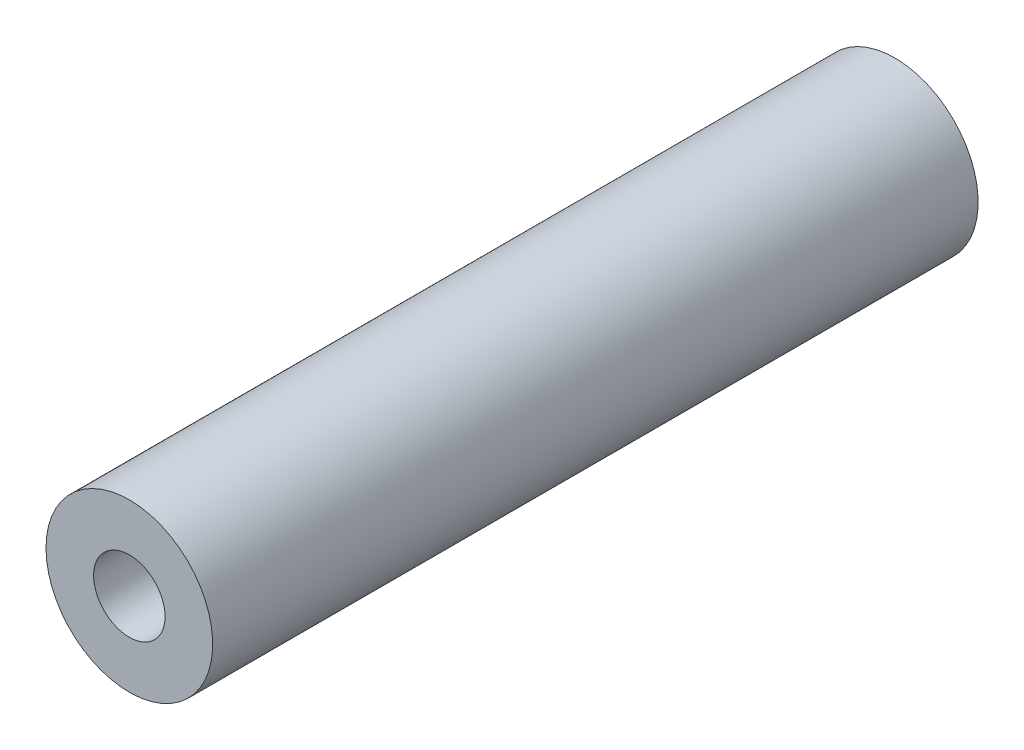
from build123d import *

# Parameters (mm, degrees)
ESBO_O1_R                = 4.9
RESSALTO_EXTRUS_O1_DEPTH = 45
PADR_OCIRCULAR1_COUNT    = 3


with BuildPart() as part:
    # Esboço1 → Ressalto-extrusão1 (new body)
    with BuildSketch(Plane.XY):
        with Locations(Location((0, 0, 0), (0, 0, 180))):
            Circle(ESBO_O1_R)
    extrude(amount=RESSALTO_EXTRUS_O1_DEPTH)

    # Esboço2 → Furo roscado de M51 (revolve, cut)
    with BuildSketch(Plane(origin=(0, 0, 45), x_dir=(0, -1, 0), z_dir=(1, 0, 0))):
        Polygon((0, 0), (0, 15.2618073), (2.1, 14), (2.1, 0), align=None)
    revolve(axis=Axis((0, 0, 51.35), (0, 0, -1)), mode=Mode.SUBTRACT)

    # Esboço6 → Furo roscado de M21 (revolve, cut)
    with BuildSketch(Plane(origin=(0, 3, 0), x_dir=(0, 1, 0), z_dir=(1, 0, 0))):
        Polygon((0, 0), (0, 8.480688495), (0.8, 8), (0.8, 0), align=None)
    furo_roscado_de_m21 = revolve(axis=Axis((0, 3, -6.35), (0, 0, 1)), mode=Mode.SUBTRACT)

    # PadrãoCircular1: Furo roscado de M21 ×3 about axis
    padr_ocircular1_axis = Axis((0, 0, 0), (0, 0, 1))
    for i in range(1, PADR_OCIRCULAR1_COUNT):
        add(furo_roscado_de_m21.rotate(padr_ocircular1_axis, i * 360 / PADR_OCIRCULAR1_COUNT), mode=Mode.SUBTRACT)


solid = part.part
